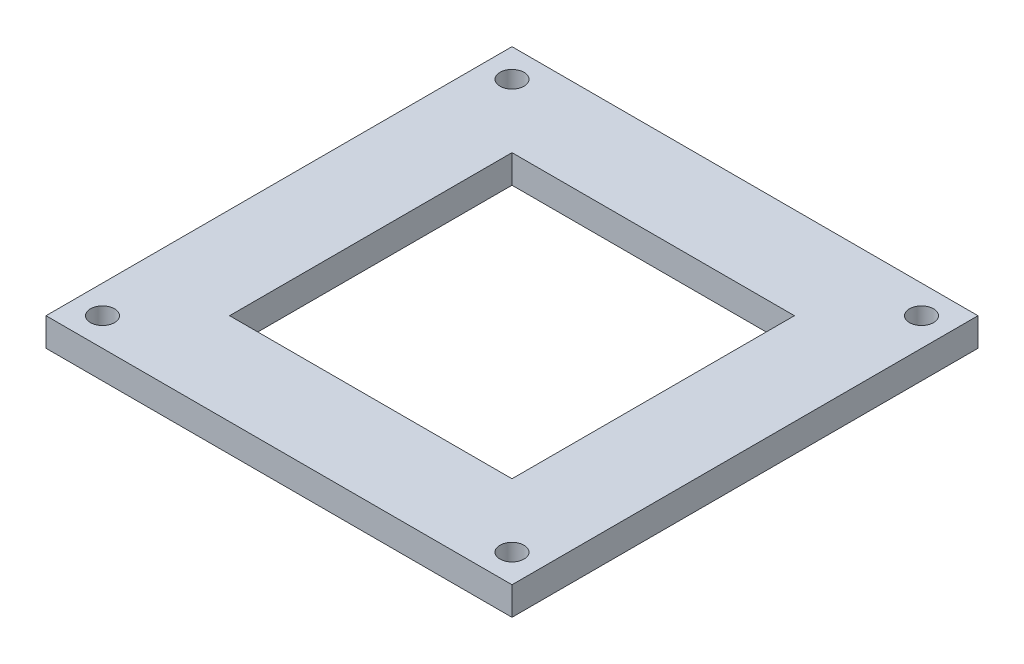
from build123d import *

# Parameters (mm, degrees)
SKETCH1_W           = 66
SKETCH1_H           = 66
SKETCH1_R           = 1.705
SKETCH1_W_2         = 40
SKETCH1_H_2         = 40
BOSS_EXTRUDE1_DEPTH = 4


with BuildPart() as part:
    # Sketch1 → Boss-Extrude1 (new body)
    with BuildSketch(Plane(origin=(0, 0, 0), x_dir=(1, 0, 0), z_dir=(0, 1, 0))):
        Rectangle(SKETCH1_W, SKETCH1_H)
        with Locations(Location((-29, 29, 0), (0, 0, 270))):
            Circle(SKETCH1_R, mode=Mode.SUBTRACT)
        with Locations(Location((29, 29, 0), (0, 0, 270))):
            Circle(SKETCH1_R, mode=Mode.SUBTRACT)
        with Locations(Location((29, -29, 0), (0, 0, 270))):
            Circle(SKETCH1_R, mode=Mode.SUBTRACT)
        with Locations(Location((-29, -29, 0), (0, 0, 270))):
            Circle(SKETCH1_R, mode=Mode.SUBTRACT)
        Rectangle(SKETCH1_W_2, SKETCH1_H_2, mode=Mode.SUBTRACT)
    extrude(amount=BOSS_EXTRUDE1_DEPTH)


solid = part.part
